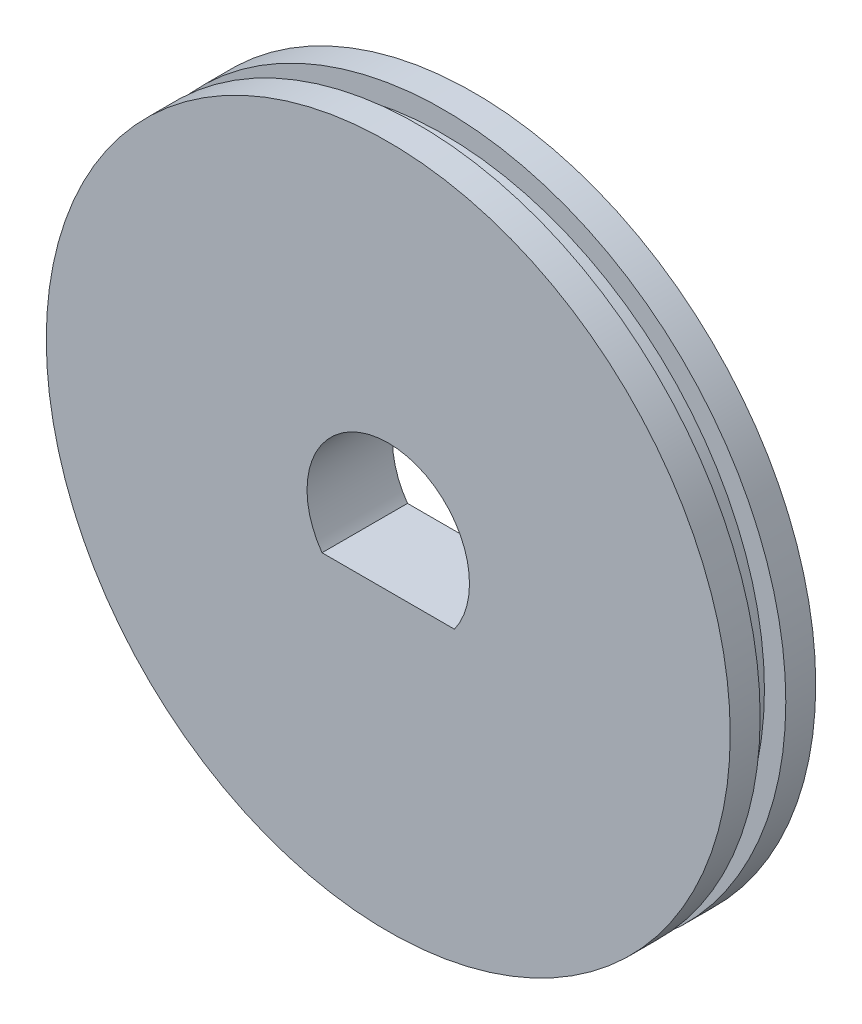
from build123d import *

# Parameters (mm, degrees)
SKETCH1_R           = 8
BOSS_EXTRUDE2_DEPTH = 2
SKETCH2_W           = 0.5
SKETCH2_H           = 0.6


with BuildPart() as part:
    # Sketch1 → Boss-Extrude2 (new body)
    with BuildSketch(Plane.XY):
        Circle(SKETCH1_R)
        with BuildLine():
            Line((-1.549193338, -1.1), (1.549193338, -1.1))
            ThreePointArc((1.549193338, -1.1), (0, 1.9), (-1.549193338, -1.1))
        make_face(mode=Mode.SUBTRACT)
    extrude(amount=BOSS_EXTRUDE2_DEPTH)

    # Sketch2 → Cut-Revolve1 (revolve, cut)
    with BuildSketch(Plane(origin=(0, 0, 0), x_dir=(1, 0, 0), z_dir=(0, 1, 0)), mode=Mode.PRIVATE) as cut_revolve1_sk:
        with Locations((-7.75, -1)):
            Rectangle(SKETCH2_W, SKETCH2_H)
    revolve(cut_revolve1_sk.sketch.rotate(Axis((0, 0, 2), (0, 0, -1)), 180), axis=Axis((0, 0, 2), (0, 0, -1)), mode=Mode.SUBTRACT)


solid = part.part
